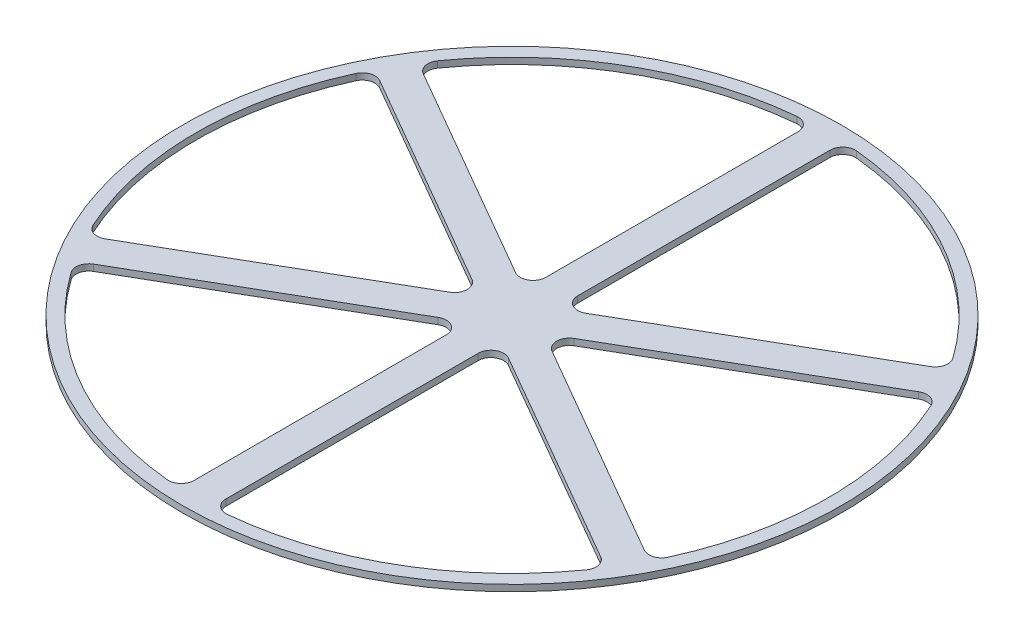
from build123d import *

# Parameters (mm, degrees)
BOSS_EXTRUDE1_DEPTH = 2.54
BOSS_EXTRUDE2_START = -2.54
BOSS_EXTRUDE2_DEPTH = 2.54
CIRPATTERN1_COUNT   = 6
FILLET1_R           = 5.08
FILLET2_R           = 5.08


with BuildPart() as part:
    # Sketch2 → Boss-Extrude1 (new body)
    with BuildSketch(Plane(origin=(0, 0, 0), x_dir=(1, 0, 0), z_dir=(0, 1, 0))):
        with BuildLine():
            Line((110.196456712, 70.954302365), (6.35, 10.998522628))
            Line((6.35, 10.998522628), (6.35, 130.910082102))
            ThreePointArc((6.35, 130.910082102), (0, 131.064), (-6.35, 130.910082102))
            Line((-6.35, 130.910082102), (-6.35, 10.998522628))
            Line((-6.35, 10.998522628), (-110.196456712, 70.954302365))
            ThreePointArc((-110.196456712, 70.954302365), (-113.504753522, 65.532), (-116.546456712, 59.955779737))
            Line((-116.546456712, 59.955779737), (-12.7, 0))
            Line((-12.7, 0), (-116.546456712, -59.955779737))
            ThreePointArc((-116.546456712, -59.955779737), (-113.504753522, -65.532), (-110.196456712, -70.954302365))
            Line((-110.196456712, -70.954302365), (-6.35, -10.998522628))
            Line((-6.35, -10.998522628), (-6.35, -130.910082102))
            ThreePointArc((-6.35, -130.910082102), (0, -131.064), (6.35, -130.910082102))
            Line((6.35, -130.910082102), (6.35, -10.998522628))
            Line((6.35, -10.998522628), (110.196456712, -70.954302365))
            ThreePointArc((110.196456712, -70.954302365), (113.504753522, -65.532), (116.546456712, -59.955779737))
            Line((116.546456712, -59.955779737), (12.7, 0))
            Line((12.7, 0), (116.546456712, 59.955779737))
            ThreePointArc((116.546456712, 59.955779737), (113.504753522, 65.532), (110.196456712, 70.954302365))
        make_face()
    extrude(amount=BOSS_EXTRUDE1_DEPTH)

    # Sketch3 → Boss-Extrude2 (add)
    with BuildSketch(Plane(origin=(0, 2.54, 0), x_dir=(1, 0, 0), z_dir=(0, 1, 0)).offset(BOSS_EXTRUDE2_START)):
        with BuildLine():
            Line((-69.85, 110.899727664), (-69.85, 104.549727664))
            ThreePointArc((-69.85, 104.549727664), (0, 125.736502475), (69.85, 104.549727664))
            Line((69.85, 104.549727664), (69.85, 110.899727664))
            ThreePointArc((69.85, 110.899727664), (0, 131.064), (-69.85, 110.899727664))
        make_face()
    boss_extrude2 = extrude(amount=BOSS_EXTRUDE2_DEPTH)

    # CirPattern1: Boss-Extrude2 ×6 about axis
    cirpattern1_axis = Axis((0, 2.54, 0), (0, -1, 0))
    for i in range(1, CIRPATTERN1_COUNT):
        add(boss_extrude2.rotate(cirpattern1_axis, i * 360 / CIRPATTERN1_COUNT))

    # Fillet1
    fillet1_edges = [part.edges().sort_by_distance(p)[0] for p in [
        (111.927053617, 1.27, -57.288766117),
        (105.577053617, 1.27, -68.287288745),
        (-6.35, 1.27, -125.576054862),
        (6.35, 1.27, -125.576054862),
        (-105.577053617, 1.27, -68.287288745),
        (-111.927053617, 1.27, -57.288766117),
        (-111.927053617, 1.27, 57.288766117),
        (-105.577053617, 1.27, 68.287288745),
        (-6.35, 1.27, 125.576054862),
        (6.35, 1.27, 125.576054862),
        (105.577053617, 1.27, 68.287288745),
        (111.927053617, 1.27, 57.288766117),
    ]]
    fillet(fillet1_edges, radius=FILLET1_R)

    # Fillet2
    fillet2_edges = [part.edges().sort_by_distance(p)[0] for p in [
        (6.35, 1.27, -10.998522628),
        (12.7, 1.27, 0),
        (6.35, 1.27, 10.998522628),
        (-6.35, 1.27, 10.998522628),
        (-12.7, 1.27, 0),
        (-6.35, 1.27, -10.998522628),
    ]]
    fillet(fillet2_edges, radius=FILLET2_R)


solid = part.part
